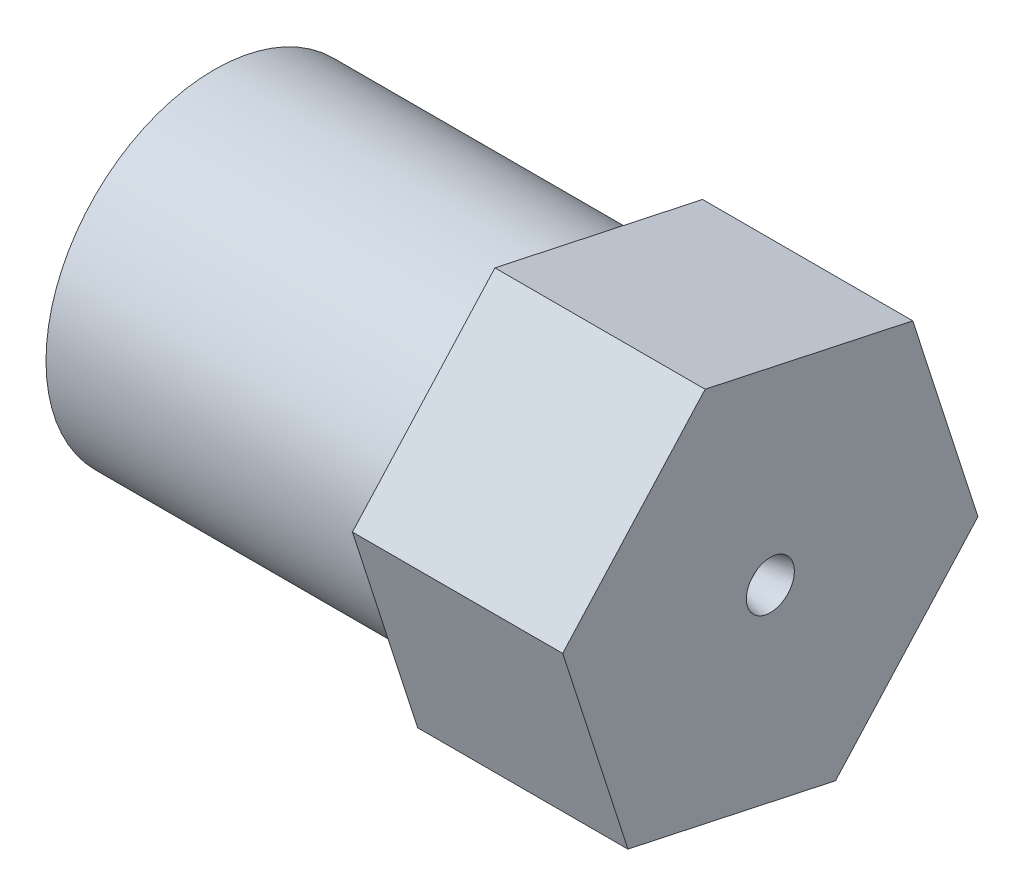
from build123d import *

# Parameters (mm, degrees)
SKETCH4_R           = 10.16
BOSS_EXTRUDE1_DEPTH = 12.7
FILLET1_R           = 0.635


with BuildPart() as part:
    # Sketch1 → Revolve1 (revolve)
    with BuildSketch(Plane.XY, mode=Mode.PRIVATE) as revolve1_sk:
        with BuildLine():
            Line((-1.060660172, 1.439339828), (-3.136384374, 3.51506403))
            ThreePointArc((-3.136384374, 3.51506403), (-4.166428506, 4.203317516), (-5.381448404, 4.445))
            Line((-5.381448404, 4.445), (-13.462, 4.445))
            Line((-13.462, 4.445), (-13.462, 4.699))
            ThreePointArc((-13.462, 4.699), (-13.499197439, 4.788802561), (-13.589, 4.826))
            Line((-13.589, 4.826), (-19.304, 4.826))
            ThreePointArc((-19.304, 4.826), (-19.753012806, 5.011987194), (-19.939, 5.461))
            Line((-19.939, 5.461), (-19.939, 6.8199))
            ThreePointArc((-19.939, 6.8199), (-19.976197439, 6.909702561), (-20.066, 6.9469))
            Line((-20.066, 6.9469), (-24.892, 6.9469))
            Line((-24.892, 6.9469), (-24.892, 7.8994))
            ThreePointArc((-24.892, 7.8994), (-24.929197439, 7.989202561), (-25.019, 8.0264))
            Line((-25.019, 8.0264), (-31.115, 8.0264))
            ThreePointArc((-31.115, 8.0264), (-31.564012806, 8.212387194), (-31.75, 8.6614))
            Line((-31.75, 8.6614), (-31.75, 10.16))
            Line((-31.75, 10.16), (-10.850079864, 10.16))
            Line((-10.850079864, 10.16), (1.849920136, 10.16))
            Line((1.849920136, 10.16), (1.849920136, 1.449137675))
            add(Edge.make_bspline(
                [(1.849920136, 1.449137675), (0.961464624, 1.324273395), (0.136808057, 1.024122952)],
                knots=[0, 0, 0, 1, 1, 1], degree=2))
            ThreePointArc((0.136808057, 1.024122952), (0.069459271, 1.006076899), (0, 1))
            ThreePointArc((0, 1), (-0.574025149, 1.114180701), (-1.060660172, 1.439339828))
        make_face()
    revolve(revolve1_sk.sketch.rotate(Axis((0, 0, 0), (1, 0, 0)), 90), axis=Axis((0, 0, 0), (1, 0, 0)))

    # Sketch4 → Boss-Extrude1 (add)
    with BuildSketch(Plane(origin=(1.849920136, 0, 0), x_dir=(0, 0, -1), z_dir=(1, 0, 0))):
        Polygon((3.940411868, -12.211607701), (12.545768424, -2.693307071), (8.605356556, 9.51830063), (-3.940411868, 12.211607701), (-12.545768424, 2.693307071), (-8.605356556, -9.51830063), align=None)
        with Locations(Location((0, 0, 0), (0, 0, 180))):
            Circle(SKETCH4_R, mode=Mode.SUBTRACT)
    extrude(amount=-BOSS_EXTRUDE1_DEPTH)

    # Fillet1
    fillet1_edges = [part.edges().sort_by_distance(p)[0] for p in [
        (-10.850079864, 0, -10.16),
    ]]
    fillet(fillet1_edges, radius=FILLET1_R)


solid = part.part
